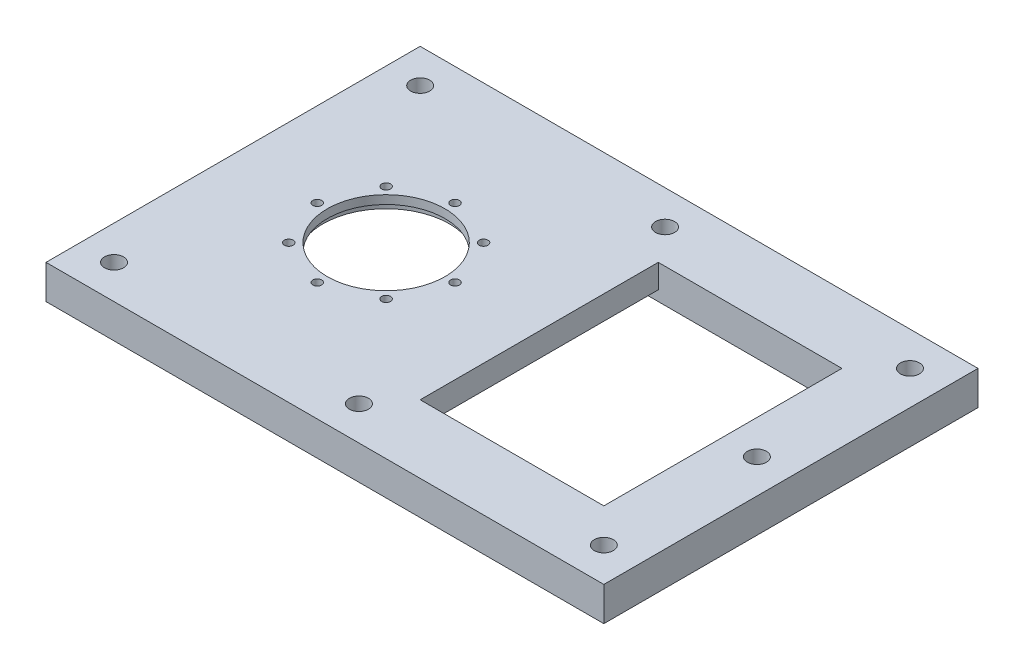
from build123d import *

# Parameters (mm, degrees)
SKETCH1_R           = 35
SKETCH1_R_2         = 17.3
BOSS_EXTRUDE1_DEPTH = 2.5
BOSS_EXTRUDE2_START = 2
SKETCH3_R           = 35
SKETCH3_R_2         = 18.6
BOSS_EXTRUDE2_DEPTH = 2
BOSS_EXTRUDE3_START = 2
SKETCH4_R           = 35
SKETCH4_R_2         = 22.3
BOSS_EXTRUDE3_DEPTH = 2
CUT_EXTRUDE1_REACH  = 51.922
SKETCH6_R           = 1.3
BOSS_EXTRUDE6_START = -10
SKETCH7_R           = 35
SKETCH7_W           = 54
SKETCH7_H           = 70
BOSS_EXTRUDE6_DEPTH = 10
SKETCH8_W           = 7
SKETCH8_H           = 70
CUT_EXTRUDE3_DEPTH  = 3
CUT_EXTRUDE4_REACH  = 133.476
SKETCH10_R          = 2.8


with BuildPart() as part:
    # Sketch1 → Boss-Extrude1 (new body)
    with BuildSketch(Plane(origin=(0, 0, 0), x_dir=(1, 0, 0), z_dir=(0, 1, 0))):
        with Locations(Location((0, 0, 0), (0, 0, 270))):
            Circle(SKETCH1_R)
        with Locations(Location((0, 0, 0), (0, 0, 270))):
            Circle(SKETCH1_R_2, mode=Mode.SUBTRACT)
    extrude(amount=BOSS_EXTRUDE1_DEPTH)

    # Sketch3 → Boss-Extrude2 (add)
    with BuildSketch(Plane.XZ.offset(BOSS_EXTRUDE2_START)):
        with Locations(Location((0, 0, 0), (0, 0, 270))):
            Circle(SKETCH3_R)
        with Locations(Location((0, 0, 0), (0, 0, 270))):
            Circle(SKETCH3_R_2, mode=Mode.SUBTRACT)
    extrude(amount=-BOSS_EXTRUDE2_DEPTH)

    # Sketch4 → Boss-Extrude3 (add)
    with BuildSketch(Plane.XZ.offset(2).offset(BOSS_EXTRUDE3_START)):
        with Locations(Location((0, 0, 0), (0, 0, 270))):
            Circle(SKETCH4_R)
        with Locations(Location((0, 0, 0), (0, 0, 270))):
            Circle(SKETCH4_R_2, mode=Mode.SUBTRACT)
    extrude(amount=-BOSS_EXTRUDE3_DEPTH)

    # Sketch6 → Cut-Extrude1 (cut, up to next)
    with BuildSketch(Plane(origin=(0, 2.5, 0), x_dir=(1, 0, 0), z_dir=(0, 1, 0)), mode=Mode.PRIVATE) as cut_extrude1_sk1:
        with Locations(Location((0, 20.25, 0), (0, 0, 270))):
            Circle(SKETCH6_R)
    cut_extrude1_tool1 = extrude(cut_extrude1_sk1.sketch, amount=-CUT_EXTRUDE1_REACH, mode=Mode.PRIVATE) & part.part
    # Sketch6 → Cut-Extrude1 (cut, up to next)
    with BuildSketch(Plane(origin=(0, 2.5, 0), x_dir=(1, 0, 0), z_dir=(0, 1, 0)), mode=Mode.PRIVATE) as cut_extrude1_sk2:
        with Locations(Location((14.318912319, 14.318912319, 0), (0, 0, 270))):
            Circle(SKETCH6_R)
    cut_extrude1_tool2 = extrude(cut_extrude1_sk2.sketch, amount=-CUT_EXTRUDE1_REACH, mode=Mode.PRIVATE) & part.part
    # Sketch6 → Cut-Extrude1 (cut, up to next)
    with BuildSketch(Plane(origin=(0, 2.5, 0), x_dir=(1, 0, 0), z_dir=(0, 1, 0)), mode=Mode.PRIVATE) as cut_extrude1_sk3:
        with Locations(Location((20.25, 0, 0), (0, 0, 270))):
            Circle(SKETCH6_R)
    cut_extrude1_tool3 = extrude(cut_extrude1_sk3.sketch, amount=-CUT_EXTRUDE1_REACH, mode=Mode.PRIVATE) & part.part
    # Sketch6 → Cut-Extrude1 (cut, up to next)
    with BuildSketch(Plane(origin=(0, 2.5, 0), x_dir=(1, 0, 0), z_dir=(0, 1, 0)), mode=Mode.PRIVATE) as cut_extrude1_sk4:
        with Locations(Location((14.318912319, -14.318912319, 0), (0, 0, 270))):
            Circle(SKETCH6_R)
    cut_extrude1_tool4 = extrude(cut_extrude1_sk4.sketch, amount=-CUT_EXTRUDE1_REACH, mode=Mode.PRIVATE) & part.part
    # Sketch6 → Cut-Extrude1 (cut, up to next)
    with BuildSketch(Plane(origin=(0, 2.5, 0), x_dir=(1, 0, 0), z_dir=(0, 1, 0)), mode=Mode.PRIVATE) as cut_extrude1_sk5:
        with Locations(Location((0, -20.25, 0), (0, 0, 270))):
            Circle(SKETCH6_R)
    cut_extrude1_tool5 = extrude(cut_extrude1_sk5.sketch, amount=-CUT_EXTRUDE1_REACH, mode=Mode.PRIVATE) & part.part
    # Sketch6 → Cut-Extrude1 (cut, up to next)
    with BuildSketch(Plane(origin=(0, 2.5, 0), x_dir=(1, 0, 0), z_dir=(0, 1, 0)), mode=Mode.PRIVATE) as cut_extrude1_sk6:
        with Locations(Location((-14.318912319, -14.318912319, 0), (0, 0, 270))):
            Circle(SKETCH6_R)
    cut_extrude1_tool6 = extrude(cut_extrude1_sk6.sketch, amount=-CUT_EXTRUDE1_REACH, mode=Mode.PRIVATE) & part.part
    # Sketch6 → Cut-Extrude1 (cut, up to next)
    with BuildSketch(Plane(origin=(0, 2.5, 0), x_dir=(1, 0, 0), z_dir=(0, 1, 0)), mode=Mode.PRIVATE) as cut_extrude1_sk7:
        with Locations(Location((-20.25, 0, 0), (0, 0, 270))):
            Circle(SKETCH6_R)
    cut_extrude1_tool7 = extrude(cut_extrude1_sk7.sketch, amount=-CUT_EXTRUDE1_REACH, mode=Mode.PRIVATE) & part.part
    # Sketch6 → Cut-Extrude1 (cut, up to next)
    with BuildSketch(Plane(origin=(0, 2.5, 0), x_dir=(1, 0, 0), z_dir=(0, 1, 0)), mode=Mode.PRIVATE) as cut_extrude1_sk8:
        with Locations(Location((-14.318912319, 14.318912319, 0), (0, 0, 270))):
            Circle(SKETCH6_R)
    cut_extrude1_tool8 = extrude(cut_extrude1_sk8.sketch, amount=-CUT_EXTRUDE1_REACH, mode=Mode.PRIVATE) & part.part
    add(cut_extrude1_tool1.solids().sort_by_distance((0, 2.5, -20.25))[0], mode=Mode.SUBTRACT)
    add(cut_extrude1_tool2.solids().sort_by_distance((14.318912, 2.5, -14.318912))[0], mode=Mode.SUBTRACT)
    add(cut_extrude1_tool3.solids().sort_by_distance((20.25, 2.5, 0))[0], mode=Mode.SUBTRACT)
    add(cut_extrude1_tool4.solids().sort_by_distance((14.318912, 2.5, 14.318912))[0], mode=Mode.SUBTRACT)
    add(cut_extrude1_tool5.solids().sort_by_distance((0, 2.5, 20.25))[0], mode=Mode.SUBTRACT)
    add(cut_extrude1_tool6.solids().sort_by_distance((-14.318912, 2.5, 14.318912))[0], mode=Mode.SUBTRACT)
    add(cut_extrude1_tool7.solids().sort_by_distance((-20.25, 2.5, 0))[0], mode=Mode.SUBTRACT)
    add(cut_extrude1_tool8.solids().sort_by_distance((-14.318912, 2.5, -14.318912))[0], mode=Mode.SUBTRACT)

    # Sketch7 → Boss-Extrude6 (add)
    with BuildSketch(Plane(origin=(0, 2.5, 0), x_dir=(1, 0, 0), z_dir=(0, 1, 0)).offset(BOSS_EXTRUDE6_START)):
        Polygon((-45, 55), (99, 55), (119, 55), (119, -55), (99, -55), (-35, -55), (-45, -55), (-45, 35), align=None)
        with Locations(Location((0, 0, 0), (0, 0, 270))):
            Circle(SKETCH7_R, mode=Mode.SUBTRACT)
        with Locations((72, 0)):
            Rectangle(SKETCH7_W, SKETCH7_H, mode=Mode.SUBTRACT)
    extrude(amount=BOSS_EXTRUDE6_DEPTH)

    # Sketch8 → Cut-Extrude3 (cut)
    with BuildSketch(Plane.XZ.offset(7.5)):
        with Locations((102.5, 0)):
            Rectangle(SKETCH8_W, SKETCH8_H)
        with Locations((41.5, 0)):
            Rectangle(SKETCH8_W, SKETCH8_H)
    extrude(amount=-CUT_EXTRUDE3_DEPTH, mode=Mode.SUBTRACT)

    # Sketch10 → Cut-Extrude4 (cut, up to next)
    with BuildSketch(Plane(origin=(0, 2.5, 0), x_dir=(1, 0, 0), z_dir=(0, 1, 0)), mode=Mode.PRIVATE) as cut_extrude4_sk1:
        with Locations(Location((37, 45, 0), (0, 0, 270))):
            Circle(SKETCH10_R)
    cut_extrude4_tool1 = extrude(cut_extrude4_sk1.sketch, amount=-CUT_EXTRUDE4_REACH, mode=Mode.PRIVATE) & part.part
    # Sketch10 → Cut-Extrude4 (cut, up to next)
    with BuildSketch(Plane(origin=(0, 2.5, 0), x_dir=(1, 0, 0), z_dir=(0, 1, 0)), mode=Mode.PRIVATE) as cut_extrude4_sk2:
        with Locations(Location((-35, 45, 0), (0, 0, 270))):
            Circle(SKETCH10_R)
    cut_extrude4_tool2 = extrude(cut_extrude4_sk2.sketch, amount=-CUT_EXTRUDE4_REACH, mode=Mode.PRIVATE) & part.part
    # Sketch10 → Cut-Extrude4 (cut, up to next)
    with BuildSketch(Plane(origin=(0, 2.5, 0), x_dir=(1, 0, 0), z_dir=(0, 1, 0)), mode=Mode.PRIVATE) as cut_extrude4_sk3:
        with Locations(Location((-35, -45, 0), (0, 0, 270))):
            Circle(SKETCH10_R)
    cut_extrude4_tool3 = extrude(cut_extrude4_sk3.sketch, amount=-CUT_EXTRUDE4_REACH, mode=Mode.PRIVATE) & part.part
    # Sketch10 → Cut-Extrude4 (cut, up to next)
    with BuildSketch(Plane(origin=(0, 2.5, 0), x_dir=(1, 0, 0), z_dir=(0, 1, 0)), mode=Mode.PRIVATE) as cut_extrude4_sk4:
        with Locations(Location((37, -45, 0), (0, 0, 270))):
            Circle(SKETCH10_R)
    cut_extrude4_tool4 = extrude(cut_extrude4_sk4.sketch, amount=-CUT_EXTRUDE4_REACH, mode=Mode.PRIVATE) & part.part
    # Sketch10 → Cut-Extrude4 (cut, up to next)
    with BuildSketch(Plane(origin=(0, 2.5, 0), x_dir=(1, 0, 0), z_dir=(0, 1, 0)), mode=Mode.PRIVATE) as cut_extrude4_sk5:
        with Locations(Location((109, 45, 0), (0, 0, 270))):
            Circle(SKETCH10_R)
    cut_extrude4_tool5 = extrude(cut_extrude4_sk5.sketch, amount=-CUT_EXTRUDE4_REACH, mode=Mode.PRIVATE) & part.part
    # Sketch10 → Cut-Extrude4 (cut, up to next)
    with BuildSketch(Plane(origin=(0, 2.5, 0), x_dir=(1, 0, 0), z_dir=(0, 1, 0)), mode=Mode.PRIVATE) as cut_extrude4_sk6:
        with Locations(Location((109, -45, 0), (0, 0, 270))):
            Circle(SKETCH10_R)
    cut_extrude4_tool6 = extrude(cut_extrude4_sk6.sketch, amount=-CUT_EXTRUDE4_REACH, mode=Mode.PRIVATE) & part.part
    # Sketch10 → Cut-Extrude4 (cut, up to next)
    with BuildSketch(Plane(origin=(0, 2.5, 0), x_dir=(1, 0, 0), z_dir=(0, 1, 0)), mode=Mode.PRIVATE) as cut_extrude4_sk7:
        with Locations(Location((109, 0, 0), (0, 0, 270))):
            Circle(SKETCH10_R)
    cut_extrude4_tool7 = extrude(cut_extrude4_sk7.sketch, amount=-CUT_EXTRUDE4_REACH, mode=Mode.PRIVATE) & part.part
    add(cut_extrude4_tool1.solids().sort_by_distance((37, 2.5, -45))[0], mode=Mode.SUBTRACT)
    add(cut_extrude4_tool2.solids().sort_by_distance((-35, 2.5, -45))[0], mode=Mode.SUBTRACT)
    add(cut_extrude4_tool3.solids().sort_by_distance((-35, 2.5, 45))[0], mode=Mode.SUBTRACT)
    add(cut_extrude4_tool4.solids().sort_by_distance((37, 2.5, 45))[0], mode=Mode.SUBTRACT)
    add(cut_extrude4_tool5.solids().sort_by_distance((109, 2.5, -45))[0], mode=Mode.SUBTRACT)
    add(cut_extrude4_tool6.solids().sort_by_distance((109, 2.5, 45))[0], mode=Mode.SUBTRACT)
    add(cut_extrude4_tool7.solids().sort_by_distance((109, 2.5, 0))[0], mode=Mode.SUBTRACT)


solid = part.part
